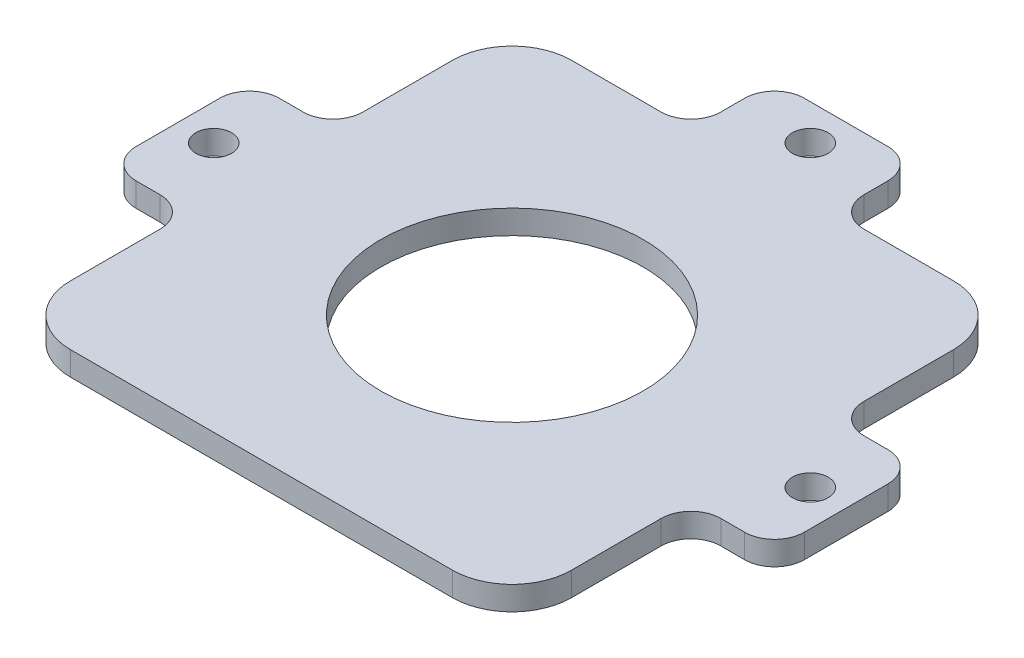
from build123d import *

# Parameters (mm, degrees)
SKETCH1_R           = 11
SKETCH1_R_2         = 1.5
BOSS_EXTRUDE1_DEPTH = 2
FILLET2_R           = 5
FILLET1_R           = 2.5


with BuildPart() as part:
    # Sketch1 → Boss-Extrude1 (new body)
    with BuildSketch(Plane(origin=(0, 0, 0), x_dir=(1, 0, 0), z_dir=(0, 1, 0))):
        Polygon((21, 6), (28, 6), (28, -6), (21, -6), (21, -21), (-21, -21), (-21, -6), (-28, -6), (-28, 6), (-21, 6), (-21, 21), (-6, 21), (-6, 28), (6, 28), (6, 21), (21, 21), align=None)
        with Locations(Location((0, 0, 0), (0, 0, 270))):
            Circle(SKETCH1_R, mode=Mode.SUBTRACT)
        with Locations(Location((-25, 0, 0), (0, 0, 270))):
            Circle(SKETCH1_R_2, mode=Mode.SUBTRACT)
        with Locations(Location((0, 25, 0), (0, 0, 270))):
            Circle(SKETCH1_R_2, mode=Mode.SUBTRACT)
        with Locations(Location((25, 0, 0), (0, 0, 270))):
            Circle(SKETCH1_R_2, mode=Mode.SUBTRACT)
    extrude(amount=BOSS_EXTRUDE1_DEPTH)

    # Fillet2
    fillet2_edges = [part.edges().sort_by_distance(p)[0] for p in [
        (21, 1, 21),
        (-21, 1, 21),
        (-21, 1, -21),
        (21, 1, -21),
    ]]
    fillet(fillet2_edges, radius=FILLET2_R)

    # Fillet1
    fillet1_edges = [part.edges().sort_by_distance(p)[0] for p in [
        (28, 1, 6),
        (21, 1, 6),
        (-21, 1, 6),
        (-28, 1, 6),
        (-28, 1, -6),
        (-21, 1, -6),
        (-6, 1, -21),
        (-6, 1, -28),
        (6, 1, -28),
        (6, 1, -21),
        (21, 1, -6),
        (28, 1, -6),
    ]]
    fillet(fillet1_edges, radius=FILLET1_R)


solid = part.part
